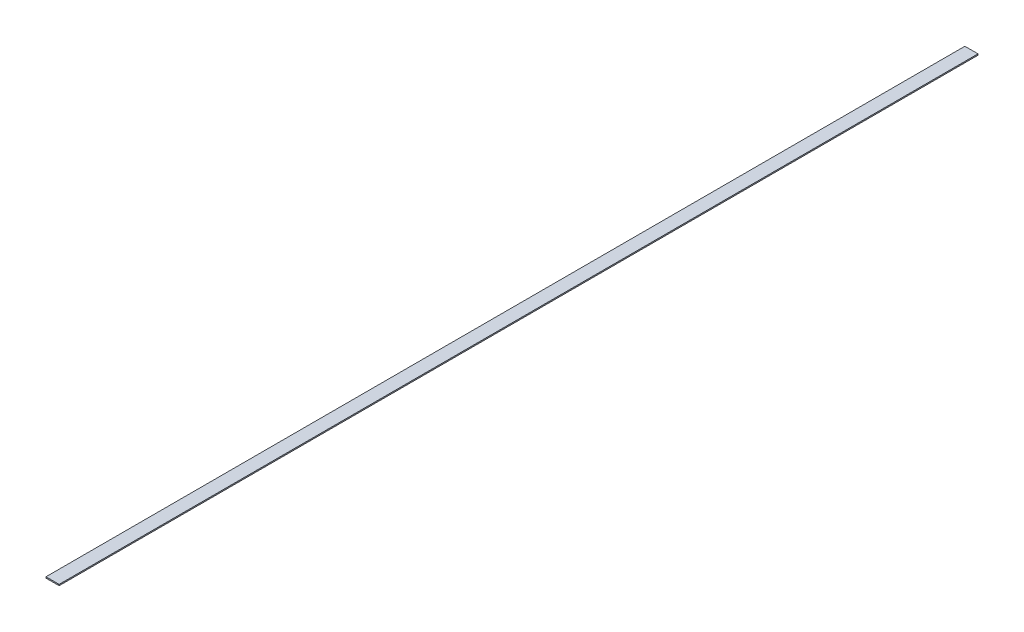
from build123d import *

# Parameters (mm, degrees)
SKETCH1_W           = 50.8
SKETCH1_H           = 4.7625
BOSS_EXTRUDE1_DEPTH = 3556


with BuildPart() as part:
    # Sketch1 → Boss-Extrude1 (new body)
    with BuildSketch(Plane.XY):
        with Locations((-19.015232349, 27.027852922)):
            Rectangle(SKETCH1_W, SKETCH1_H)
    extrude(amount=BOSS_EXTRUDE1_DEPTH)


solid = part.part
